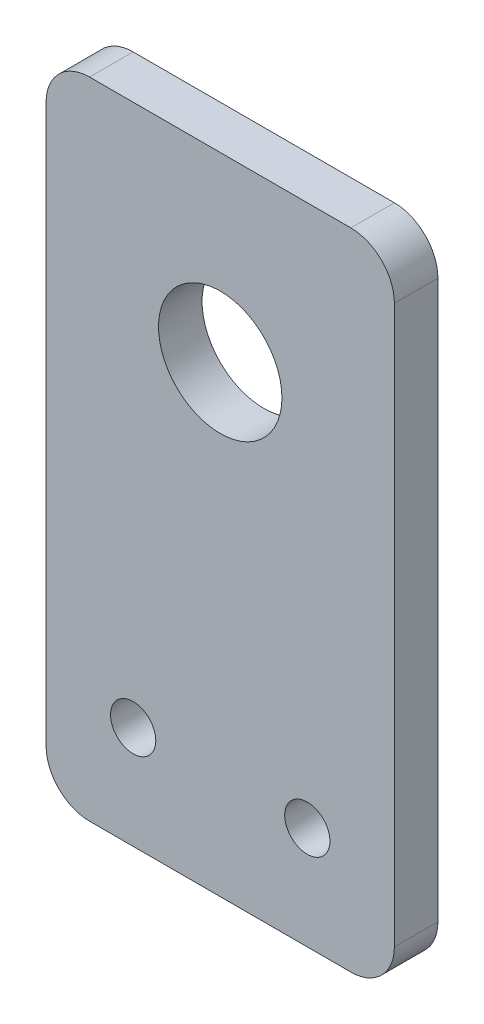
from build123d import *

# Parameters (mm, degrees)
SKETCH1_W             = 25.4
SKETCH1_H             = 47
BOSS_EXTRUDE1_DEPTH   = 3.175
SKETCH2_R             = 4.5
CUT_EXTRUDE1_DEPTH    = 27.90019749
FILLET1_R             = 3.175
M4X0_7_TAPPED_HOLE1_D = 3.3


with BuildPart() as part:
    # Sketch1 → Boss-Extrude1 (new body)
    with BuildSketch(Plane.XY):
        Rectangle(SKETCH1_W, SKETCH1_H)
    extrude(amount=BOSS_EXTRUDE1_DEPTH)

    # Sketch2 → Cut-Extrude1 (cut, through all)
    with BuildSketch(Plane.XY.offset(3.175)):
        with Locations((0, 10.25)):
            Circle(SKETCH2_R)
    extrude(amount=-CUT_EXTRUDE1_DEPTH, mode=Mode.SUBTRACT)

    # Fillet1
    fillet1_edges = [part.edges().sort_by_distance(p)[0] for p in [
        (12.7, -23.5, 1.5875),
        (-12.7, -23.5, 1.5875),
        (-12.7, 23.5, 1.5875),
        (12.7, 23.5, 1.5875),
    ]]
    fillet(fillet1_edges, radius=FILLET1_R)

    # M4x0.7 Tapped Hole1 (through all)
    with Locations(Plane.XY.offset(3.175)):
        with Locations((-6.35, -16), (6.35, -16)):
            Hole(M4X0_7_TAPPED_HOLE1_D / 2)


solid = part.part
